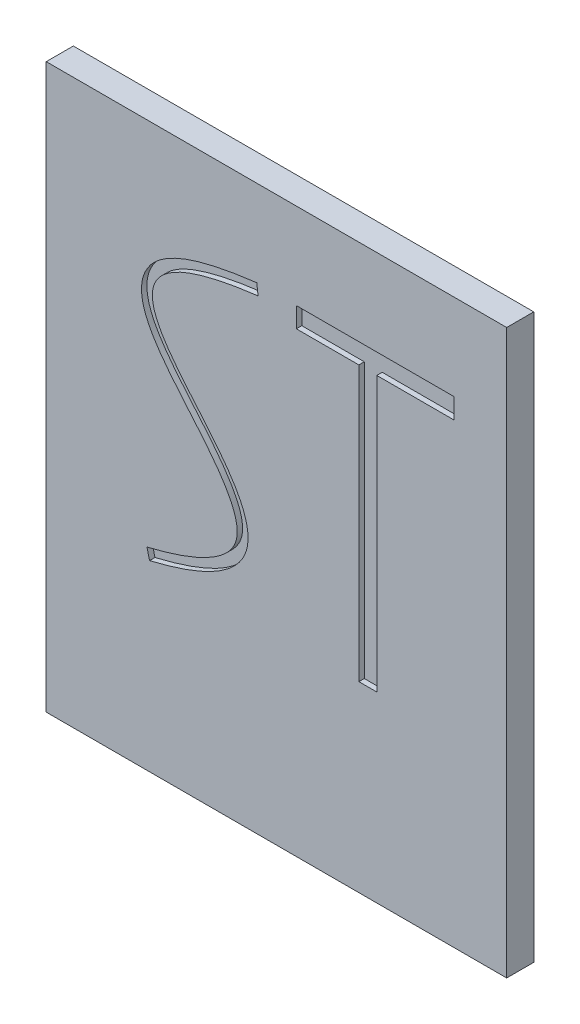
from build123d import *

# Parameters (mm, degrees)
ESQUISSE1_W             = 85
ESQUISSE1_H             = 104
BOSS_EXTRU_1_DEPTH      = 5
ENL_V_MAT_EXTRU_1_DEPTH = 1


with BuildPart() as part:
    # Esquisse1 → Boss.-Extru.1 (new body)
    with BuildSketch(Plane.XY):
        Rectangle(ESQUISSE1_W, ESQUISSE1_H)
    extrude(amount=BOSS_EXTRU_1_DEPTH)

    # Esquisse2 → Enlèv. mat.-Extru.1 (cut)
    with BuildSketch(Plane.XY.offset(5)):
        with BuildLine():
            Line((-3.388704743, 34.103347729), (-3.629372262, 36.088814713))
            add(Edge.make_bspline(
                [(-3.629372262, 36.088814713), (-4.08446723, 36.033650574), (-5.006701542, 35.9161817), (-6.746497307, 35.671464418), (-8.798619642, 35.338764173), (-11.051315829, 34.899553303), (-13.794606999, 34.259481961), (-16.756038002, 33.355809903), (-20.588465233, 31.672600674), (-23.248873274, 29.537403505), (-24.667920032, 26.786198992), (-25.012510364, 24.584115997), (-24.750697932, 22.431783349), (-23.816704413, 19.677670295), (-21.84557106, 16.358099799), (-18.729299599, 12.379297822), (-15.297978173, 8.393157934), (-12.02002896, 4.459655747), (-9.304947101, 0.658444927), (-7.548030079, -2.872596094), (-7.129469845, -5.366220488), (-7.41085698, -7.099431702), (-7.956615785, -8.371154177), (-8.945556146, -9.690172763), (-10.501310687, -11.060812544), (-12.710120912, -12.44358626), (-15.141117913, -13.572373646), (-17.46240655, -14.446520725), (-19.395427087, -15.084638487), (-21.175073092, -15.600848156), (-22.692644923, -16.001059417), (-23.500194879, -16.200847405), (-23.898925586, -16.296466212)],
                knots=[0, 0, 0, 0, 0.0078125, 0.015625, 0.03125, 0.046875, 0.0625, 0.09375, 0.125, 0.1875, 0.21875, 0.25, 0.28125, 0.3125, 0.375, 0.4375, 0.5, 0.5625, 0.625, 0.6875, 0.75, 0.78125, 0.8125, 0.84375, 0.875, 0.90625, 0.9375, 0.953125, 0.96875, 0.984375, 0.9921875, 1, 1, 1, 1], degree=3))
            Line((-23.898925586, -16.296466212), (-23.432532795, -18.24132553))
            add(Edge.make_bspline(
                [(-3.388704743, 34.103347729), (-33.854005817, 30.410509476), (-10.88452908, 9.31946477), (2.016071314, -12.138547096), (-23.432532795, -18.24132553)],
                knots=[0, 0, 0, 0, 0.521998932, 1, 1, 1, 1], degree=3))
        make_face()
        Polygon((3.677105146, 36.088814713), (32.805545913, 36.088814713), (32.805545913, 32.348096387), (18.529725933, 32.348096387), (18.529725933, -18.26617445), (15.213121291, -18.26617445), (15.213121291, 32.372945307), (3.677105146, 32.372945307), align=None)
    extrude(amount=-ENL_V_MAT_EXTRU_1_DEPTH, mode=Mode.SUBTRACT)


solid = part.part
